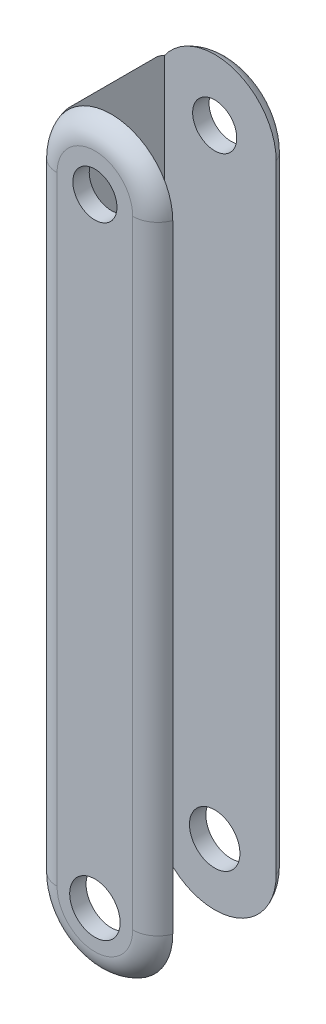
from build123d import *

# Parameters (mm, degrees)
BASE_EXTRUSION_DEPTH    = 10.8
CONG_1_R                = 2
CONG_3_R                = 2
ENL_V_MAT_EXTRU_4_DEPTH = 9
ESQUISSE7_W             = 8.2
ESQUISSE7_H             = 10.06
ENL_V_MAT_EXTRU_5_DEPTH = 9
ESQUISSE8_R             = 2
ESQUISSE8_R_2           = 1.75
ENL_V_MAT_EXTRU_6_DEPTH = 56.825441717


with BuildPart() as part:
    # Esquisse1 → Base-Extrusion (new body)
    with BuildSketch(Plane.XY):
        with BuildLine():
            Line((0, 49), (0, 0))
            ThreePointArc((0, 0), (5, -5), (10, 0))
            Line((10, 0), (10, 49))
            ThreePointArc((10, 49), (5, 54), (0, 49))
        make_face()
    extrude(amount=BASE_EXTRUSION_DEPTH)

    # Congé1
    cong_1_edges = [part.edges().sort_by_distance(p)[0] for p in [
        (5, -5, 10.8),
        (10, 24.5, 10.8),
        (5, 54, 10.8),
        (0, 24.5, 10.8),
    ]]
    fillet(cong_1_edges, radius=CONG_1_R)

    # Congé3
    cong_3_edges = [part.edges().sort_by_distance(p)[0] for p in [
        (10, 24.5, 0),
        (5, -5, 0),
        (0, 24.5, 0),
        (5, 54, 0),
    ]]
    fillet(cong_3_edges, radius=CONG_3_R)

    # Esquisse6 → Enlèv. mat.-Extru.4 (cut)
    with BuildSketch(Plane(origin=(10, 0, 0), x_dir=(0, 0, -1), z_dir=(1, 0, 0))):
        Polygon((-9.5, 58.014149953), (-9.5, -9.353860788), (-1.3, -9.353860788), (-1.3, 56.548715687), align=None)
    extrude(amount=-ENL_V_MAT_EXTRU_4_DEPTH, mode=Mode.SUBTRACT)

    # Esquisse7 → Enlèv. mat.-Extru.5 (cut)
    with BuildSketch(Plane.ZY):
        with Locations((5.4, 0.429072807)):
            Rectangle(ESQUISSE7_W, ESQUISSE7_H)
    extrude(amount=-ENL_V_MAT_EXTRU_5_DEPTH, mode=Mode.SUBTRACT)

    # Esquisse8 → Enlèv. mat.-Extru.6 (cut, through all)
    with BuildSketch(Plane(origin=(0, 0, 0), x_dir=(-1, 0, 0), z_dir=(0, 0, -1))):
        with Locations((-5, 0)):
            Circle(ESQUISSE8_R)
        with Locations((-5, 49)):
            Circle(ESQUISSE8_R_2)
    extrude(amount=-ENL_V_MAT_EXTRU_6_DEPTH, mode=Mode.SUBTRACT)


solid = part.part
